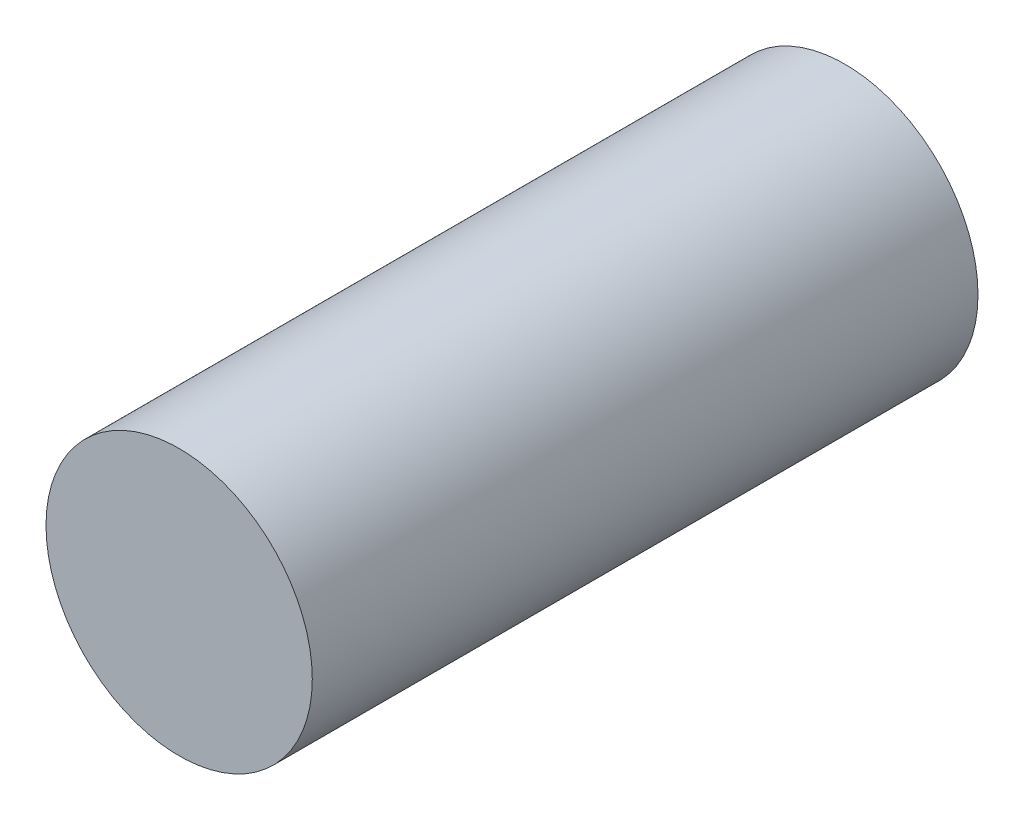
from build123d import *

# Parameters (mm, degrees)
SKETCH1_R           = 3
BOSS_EXTRUDE1_DEPTH = 15


with BuildPart() as part:
    # Sketch1 → Boss-Extrude1 (new body)
    with BuildSketch(Plane.XY):
        Circle(SKETCH1_R)
    extrude(amount=BOSS_EXTRUDE1_DEPTH)


solid = part.part
